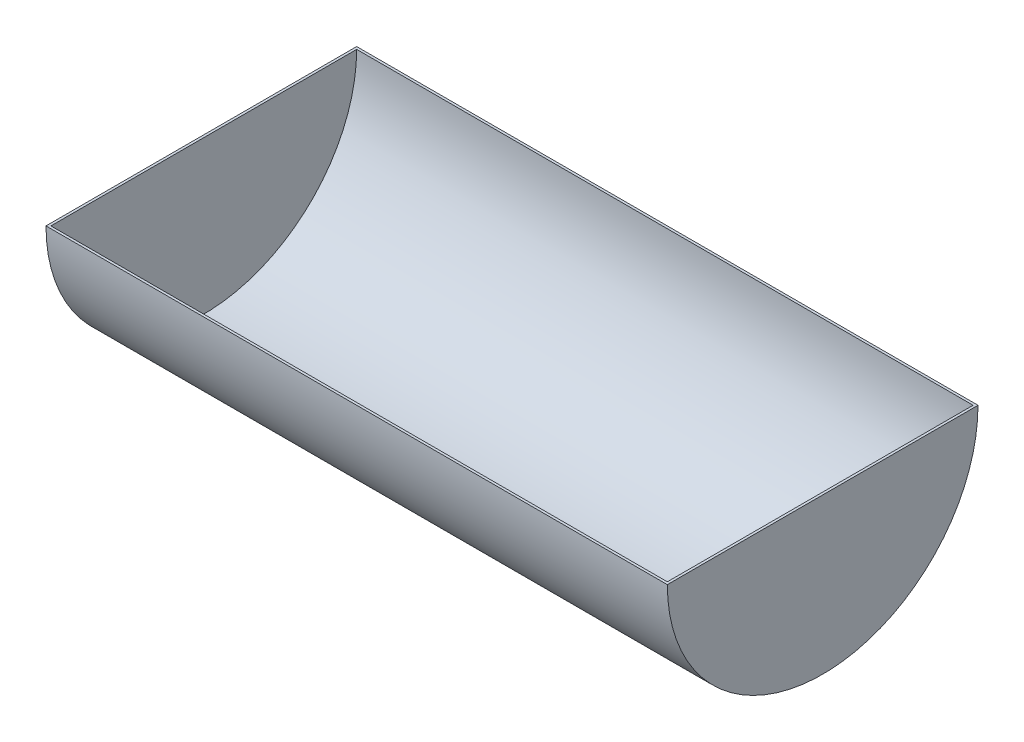
from build123d import *

# Parameters (mm, degrees)
BOSS_EXTRUDE1_DEPTH = 508
BOSS_EXTRUDE2_START = -2
BOSS_EXTRUDE2_DEPTH = 2
LPATTERN1_COUNT     = 2
LPATTERN1_PITCH     = 506


with BuildPart() as part:
    # Sketch1 → Boss-Extrude1 (new body)
    with BuildSketch(Plane(origin=(0, 0, 0), x_dir=(0, 0, -1), z_dir=(1, 0, 0))):
        with BuildLine():
            Line((127, 0), (125, 0))
            ThreePointArc((125, 0), (0, -125), (-125, 0))
            Line((-125, 0), (-127, 0))
            ThreePointArc((-127, 0), (0, -127), (127, 0))
        make_face()
    extrude(amount=BOSS_EXTRUDE1_DEPTH)

    # Sketch2 → Boss-Extrude2 (add)
    with BuildSketch(Plane(origin=(508, 0, 0), x_dir=(0, 0, -1), z_dir=(1, 0, 0)).offset(BOSS_EXTRUDE2_START)):
        with BuildLine():
            Line((-125, 0), (125, 0))
            ThreePointArc((125, 0), (0, -125), (-125, 0))
        make_face()
    boss_extrude2 = extrude(amount=BOSS_EXTRUDE2_DEPTH)

    # LPattern1: Boss-Extrude2 ×2
    with Locations(*[(-i * LPATTERN1_PITCH, 0, 0) for i in range(1, LPATTERN1_COUNT)]):
        add(boss_extrude2)


solid = part.part
